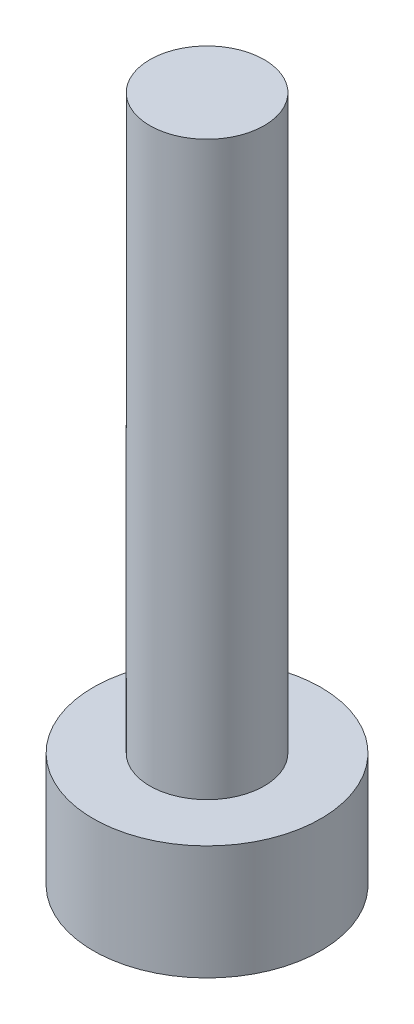
from build123d import *

# Parameters (mm, degrees)
SKETCH_1_R      = 1
EXTRUDE_1_DEPTH = 10
SKETCH_2_R      = 1.99
EXTRUDE_2_DEPTH = 2


with BuildPart() as part:
    # 草图1 → 凸台-拉伸1 (new body)
    with BuildSketch(Plane(origin=(0, 0, 0), x_dir=(1, 0, 0), z_dir=(0, 1, 0))):
        with Locations(Location((0, 0, 0), (0, 0, 270))):
            Circle(SKETCH_1_R)
    extrude(amount=EXTRUDE_1_DEPTH)

    # 草图2 → 凸台-拉伸2 (add)
    with BuildSketch(Plane.XZ):
        with Locations(Location((0, 0, 0), (0, 0, 270))):
            Circle(SKETCH_2_R)
    extrude(amount=EXTRUDE_2_DEPTH)


solid = part.part
